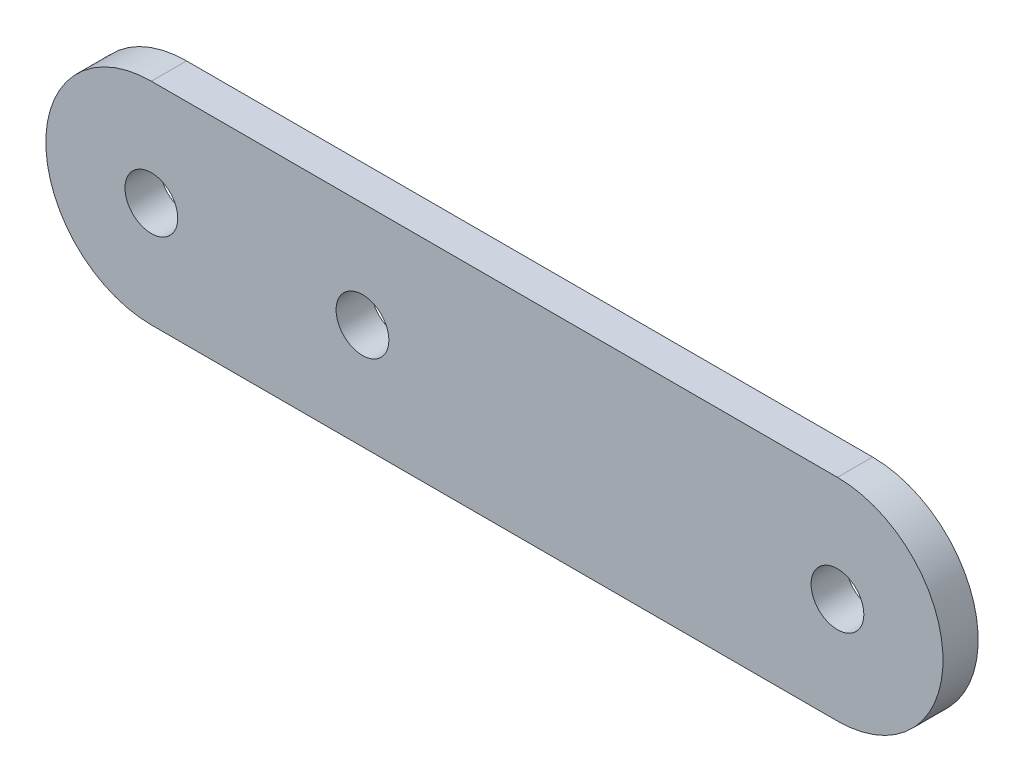
from build123d import *

# Parameters (mm, degrees)
ESQUISSE1_R        = 1.5
BOSS_EXTRU_1_DEPTH = 2


with BuildPart() as part:
    # Esquisse1 → Boss.-Extru.1 (new body)
    with BuildSketch(Plane.XY):
        with BuildLine():
            Line((0, 6), (39, 6))
            ThreePointArc((39, 6), (45, 0), (39, -6))
            Line((39, -6), (0, -6))
            ThreePointArc((0, -6), (-6, 0), (0, 6))
        make_face()
        Circle(ESQUISSE1_R, mode=Mode.SUBTRACT)
        with Locations((39, 0)):
            Circle(ESQUISSE1_R, mode=Mode.SUBTRACT)
        with Locations((12, 0)):
            Circle(ESQUISSE1_R, mode=Mode.SUBTRACT)
    extrude(amount=BOSS_EXTRU_1_DEPTH)


solid = part.part
